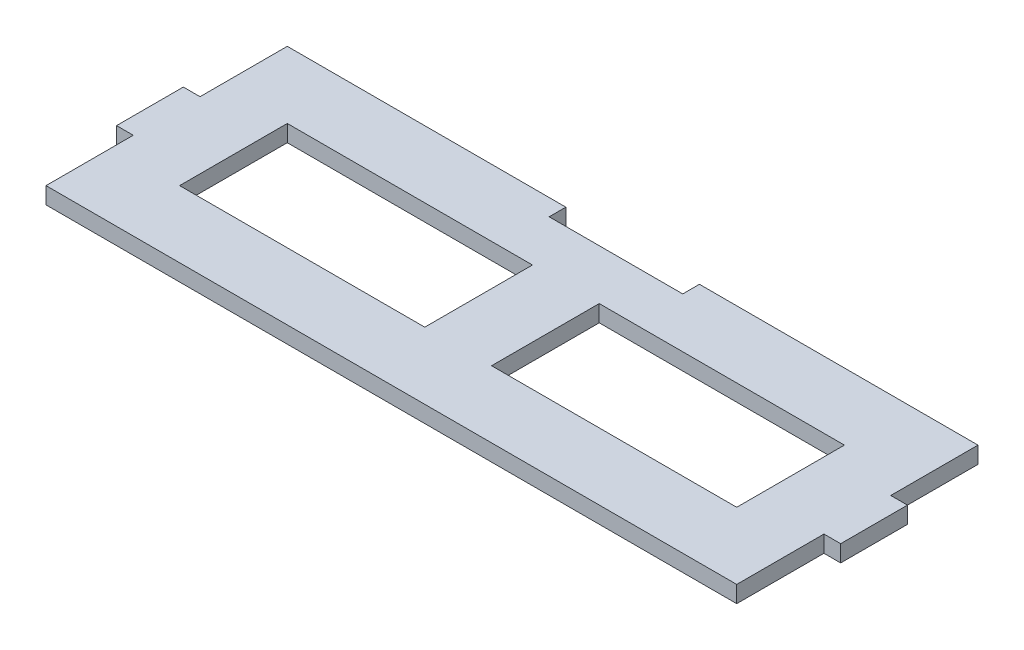
from build123d import *

# Parameters (mm, degrees)
SKETCH1_W           = 46.609
SKETCH1_H           = 20.4724
BOSS_EXTRUDE1_DEPTH = 3.175


with BuildPart() as part:
    # Sketch1 → Boss-Extrude1 (new body)
    with BuildSketch(Plane(origin=(0, 0, 0), x_dir=(1, 0, 0), z_dir=(0, 1, 0))):
        Polygon((-65.659, 22.9362), (-12.7, 22.9362), (-12.7, 19.7612), (12.7, 19.7612), (12.7, 22.9362), (65.659, 22.9362), (65.659, 6.35), (68.834, 6.35), (68.834, -6.35), (65.659, -6.35), (65.659, -22.9362), (-65.659, -22.9362), (-65.659, -6.35), (-68.834, -6.35), (-68.834, 6.35), (-65.659, 6.35), align=None)
        with Locations((-29.6545, 0)):
            Rectangle(SKETCH1_W, SKETCH1_H, mode=Mode.SUBTRACT)
        with Locations((29.6545, 0)):
            Rectangle(SKETCH1_W, SKETCH1_H, mode=Mode.SUBTRACT)
    extrude(amount=BOSS_EXTRUDE1_DEPTH)


solid = part.part
